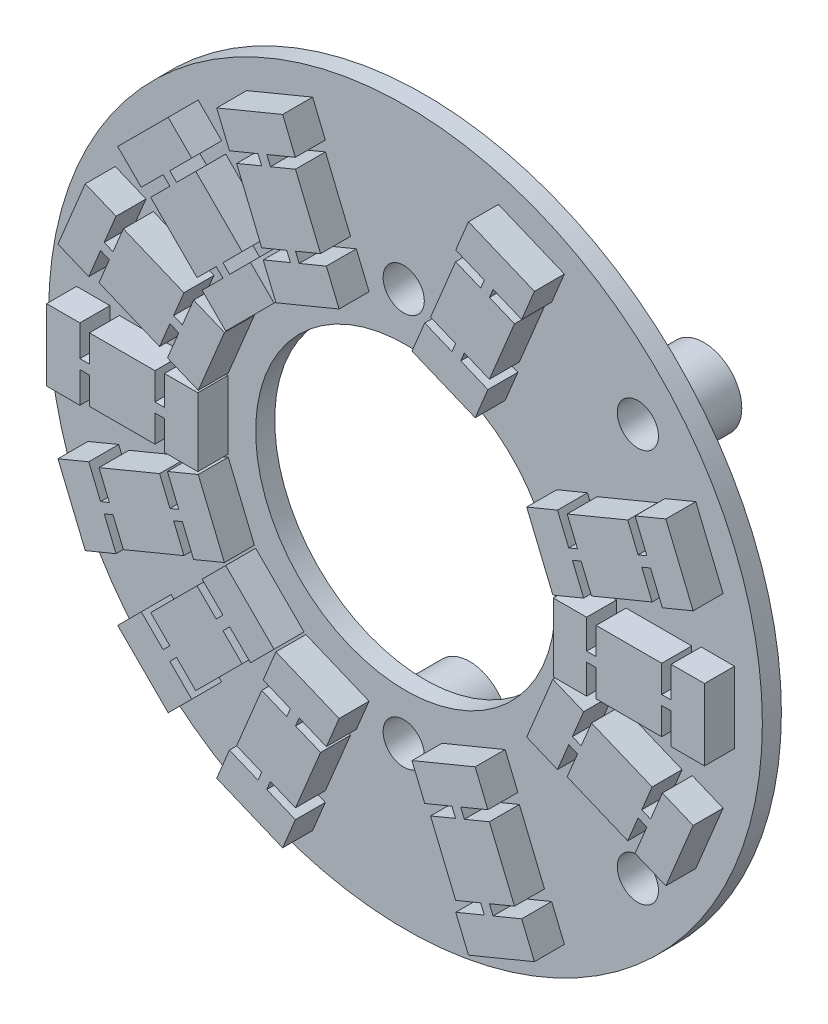
from build123d import *

# Parameters (mm, degrees)
SKETCH3_R           = 19.05
SKETCH3_R_2         = 1.1
SKETCH3_R_3         = 8.000451669
BOSS_EXTRUDE1_DEPTH = 1.016
BOSS_EXTRUDE3_START = 0.94
SKETCH5_R           = 2.032
SKETCH5_R_2         = 1.1
BOSS_EXTRUDE3_DEPTH = 2.5
BOSS_EXTRUDE4_START = 1.016
BOSS_EXTRUDE4_DEPTH = 1.6
CIRPATTERN1_COUNT   = 16


with BuildPart() as part:
    # Sketch3 → Boss-Extrude1 (new body)
    with BuildSketch(Plane.XY):
        with Locations((-2.482005269, 0.088541306)):
            Circle(SKETCH3_R)
        with Locations((-2.578909754, -10.403137109)):
            Circle(SKETCH3_R_2, mode=Mode.SUBTRACT)
        with Locations((9.921090246, -10.403137109)):
            Circle(SKETCH3_R_2, mode=Mode.SUBTRACT)
        with Locations((-2.578909754, 10.596862891)):
            Circle(SKETCH3_R_2, mode=Mode.SUBTRACT)
        with Locations((9.921090246, 10.596862891)):
            Circle(SKETCH3_R_2, mode=Mode.SUBTRACT)
        with Locations((-2.482005269, 0.088541306)):
            Circle(SKETCH3_R_3, mode=Mode.SUBTRACT)
    extrude(amount=BOSS_EXTRUDE1_DEPTH)

    # Sketch5 → Boss-Extrude3 (add)
    # profile 1 of 4: a face of its own
    with BuildSketch(Plane(origin=(-0.074220645, 0.002647695, -3.44), x_dir=(1, 0, 0), z_dir=(0, 0, 1)).offset(BOSS_EXTRUDE3_START)):
        with Locations((-2.504689109, -10.405784804)):
            Circle(SKETCH5_R)
        with Locations((-2.504689109, -10.405784804)):
            Circle(SKETCH5_R_2, mode=Mode.SUBTRACT)
    # profile 2 of 4: a face of its own
    with BuildSketch(Plane(origin=(-0.074220645, 0.002647695, -3.44), x_dir=(1, 0, 0), z_dir=(0, 0, 1)).offset(BOSS_EXTRUDE3_START)):
        with Locations((9.995310891, -10.405784804)):
            Circle(SKETCH5_R)
        with Locations((9.995310891, -10.405784804)):
            Circle(SKETCH5_R_2, mode=Mode.SUBTRACT)
    # profile 3 of 4: a face of its own
    with BuildSketch(Plane(origin=(-0.074220645, 0.002647695, -3.44), x_dir=(1, 0, 0), z_dir=(0, 0, 1)).offset(BOSS_EXTRUDE3_START)):
        with Locations((-2.504689109, 10.594215196)):
            Circle(SKETCH5_R)
        with Locations((-2.504689109, 10.594215196)):
            Circle(SKETCH5_R_2, mode=Mode.SUBTRACT)
    # profile 4 of 4: a face of its own
    with BuildSketch(Plane(origin=(-0.074220645, 0.002647695, -3.44), x_dir=(1, 0, 0), z_dir=(0, 0, 1)).offset(BOSS_EXTRUDE3_START)):
        with Locations((9.995310891, 10.594215196)):
            Circle(SKETCH5_R)
        with Locations((9.995310891, 10.594215196)):
            Circle(SKETCH5_R_2, mode=Mode.SUBTRACT)
    extrude(amount=BOSS_EXTRUDE3_DEPTH)

    # Sketch9 → Boss-Extrude4 (add)
    with BuildSketch(Plane.XY.offset(BOSS_EXTRUDE4_START)):
        Polygon((-17.757231104, -1.611458694), (-14.257231104, -1.611458694), (-14.257231104, -0.165458694), (-13.749231104, -0.165458694), (-13.749231104, -1.736139528), (-11.971231104, -1.736139528), (-11.971231104, 1.913222139), (-13.749231104, 1.913222139), (-13.749231104, 0.342541306), (-14.257231104, 0.342541306), (-14.257231104, 1.788541306), (-17.757231104, 1.788541306), (-17.757231104, 0.342541306), (-18.265231104, 0.342541306), (-18.265231104, 1.993541306), (-20.043231104, 1.993541306), (-20.043231104, -1.816458694), (-18.265231104, -1.816458694), (-18.265231104, -0.165458694), (-17.757231104, -0.165458694), align=None)
    boss_extrude4 = extrude(amount=BOSS_EXTRUDE4_DEPTH)

    # CirPattern1: Boss-Extrude4 ×16 about axis, 4 skipped
    cirpattern1_axis = Axis((-2.482005269, 0.088541306, 0), (0, 0, 1))
    add([boss_extrude4.rotate(cirpattern1_axis, i * 360 / CIRPATTERN1_COUNT) for i in range(1, CIRPATTERN1_COUNT) if i not in (4, 6, 10, 12)])


solid = part.part
